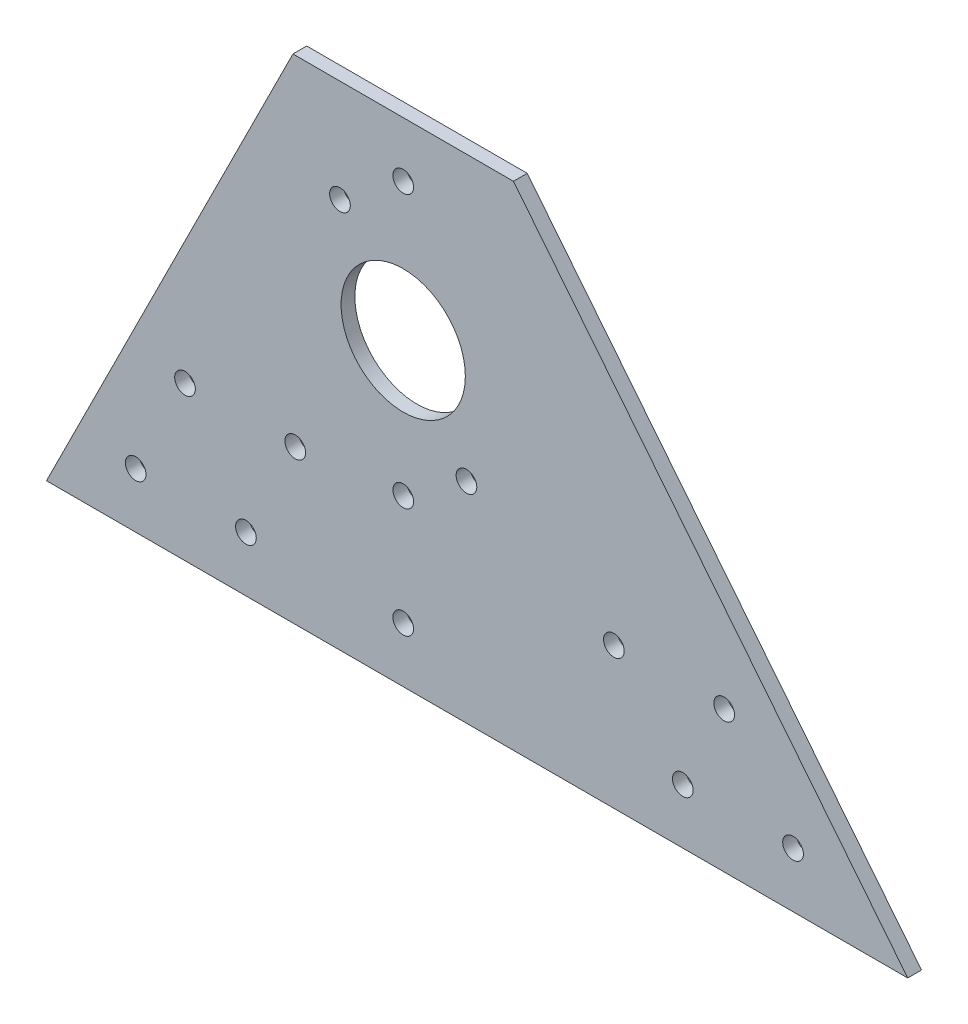
from build123d import *

# Parameters (mm, degrees)
SKETCH1_W           = 50.8
SKETCH1_H           = 113.538
SKETCH1_R           = 14.3129
BOSS_EXTRUDE1_DEPTH = 3.175
SKETCH2_R           = 2.38125
CUT_EXTRUDE1_DEPTH  = 130.392622385
SKETCH3_R           = 2.38125
CUT_EXTRUDE2_DEPTH  = 130.392622385
SKETCH4_R           = 2.38125
CUT_EXTRUDE3_DEPTH  = 130.392622385


with BuildPart() as part:
    # Sketch1 → Boss-Extrude1 (new body)
    # profile 1 of 3: a face of its own
    with BuildSketch(Plane.XY):
        Polygon((-25.4, 56.769), (-82.181258838, -56.769), (-25.4, -56.769), align=None)
    # profile 2 of 3: a face of its own
    with BuildSketch(Plane.XY):
        Rectangle(SKETCH1_W, SKETCH1_H)
        with Locations((0, 12.319)):
            Circle(SKETCH1_R, mode=Mode.SUBTRACT)
    # profile 3 of 3: a face of its own
    with BuildSketch(Plane.XY):
        Polygon((116.231023146, -56.769), (25.4, -56.769), (25.4, 56.769), align=None)
    extrude(amount=BOSS_EXTRUDE1_DEPTH)

    # Sketch2 → Cut-Extrude1 (cut, through all)
    with BuildSketch(Plane.XY.offset(3.175)):
        with Locations((-61.630242658, -44.069)):
            Circle(SKETCH2_R)
        with Locations((-36.230242658, -44.069)):
            Circle(SKETCH2_R)
        with Locations((-50.269055108, -21.351530567)):
            Circle(SKETCH2_R)
        with Locations((-24.869055108, -21.351530567)):
            Circle(SKETCH2_R)
        with Locations((64.406974336, -44.069)):
            Circle(SKETCH2_R)
        with Locations((89.806974336, -44.069)):
            Circle(SKETCH2_R)
        with Locations((48.539653752, -24.234985342)):
            Circle(SKETCH2_R)
        with Locations((73.939653752, -24.234985342)):
            Circle(SKETCH2_R)
    extrude(amount=-CUT_EXTRUDE1_DEPTH, mode=Mode.SUBTRACT)

    # Sketch3 → Cut-Extrude2 (cut, through all)
    with BuildSketch(Plane.XY.offset(3.175)):
        with Locations((0, 44.069)):
            Circle(SKETCH3_R)
        with Locations((0, -18.669)):
            Circle(SKETCH3_R)
        with Locations((0, -44.069)):
            Circle(SKETCH3_R)
    extrude(amount=-CUT_EXTRUDE2_DEPTH, mode=Mode.SUBTRACT)

    # Sketch4 → Cut-Extrude3 (cut, through all)
    with BuildSketch(Plane.XY.offset(3.175)):
        with Locations((-14.568841483, 33.125461925)):
            Circle(SKETCH4_R)
        with Locations((14.568841483, -8.487461925)):
            Circle(SKETCH4_R)
    extrude(amount=-CUT_EXTRUDE3_DEPTH, mode=Mode.SUBTRACT)


solid = part.part
